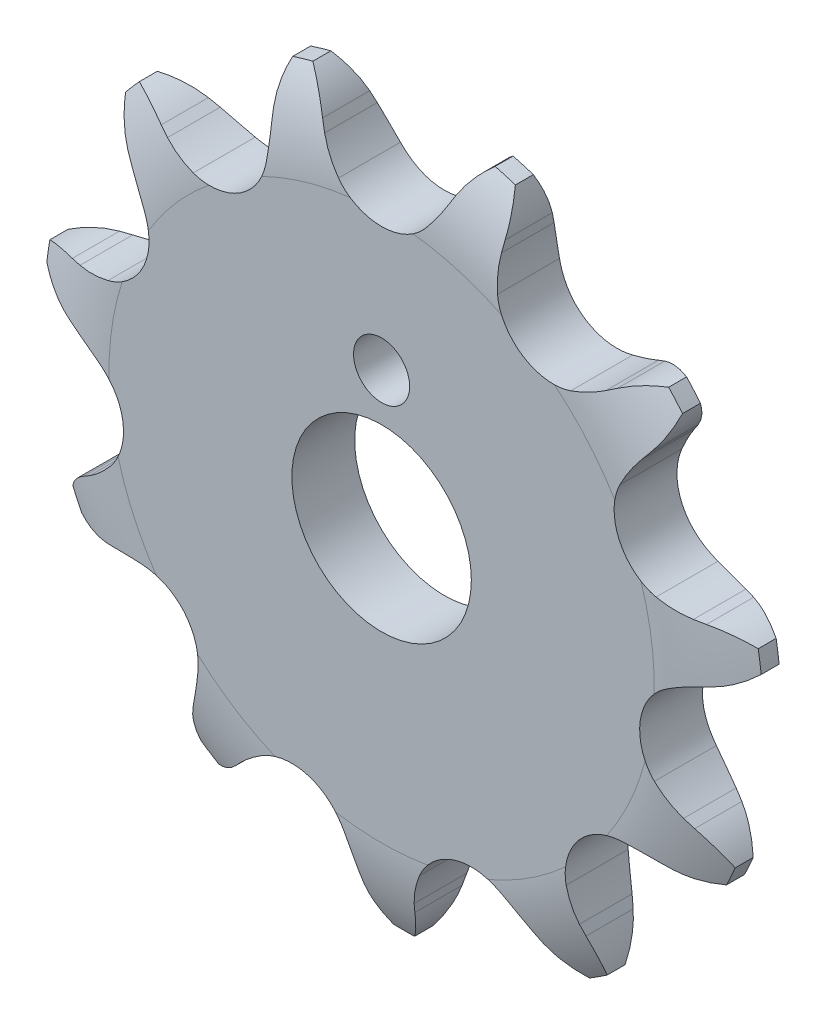
from build123d import *

# Parameters (mm, degrees)
CUT_EXTRUDE1_DEPTH      = 23.702796484
CIRPATTERN1_COUNT       = 11
BOSS_EXTRUDE1_START     = 1.4
SKETCH2_R               = 9
BOSS_EXTRUDE1_DEPTH     = 10.2
CUT_EXTRUDE2_DEPTH      = 26.391477167
CUT_EXTRUDE2_DEPTH_BACK = 26.391477167
SKETCH3_R               = 4
SKETCH4_W               = 2.1
SKETCH4_H               = 7.124886824
SKETCH6_R               = 10
CUT_EXTRUDE5_DEPTH      = 20
SKETCH7_R               = 1.25
CUT_EXTRUDE6_DEPTH      = 2.8


with BuildPart() as part:
    # Sketch1 → Revolve1 (revolve)
    with BuildSketch(Plane(origin=(0, 0, 0), x_dir=(0, 0, -1), z_dir=(1, 0, 0))):
        with BuildLine():
            Line((1.4, 0), (-1.4, 0))
            Line((-1.4, 0), (-1.4, 12.149765609))
            ThreePointArc((-1.4, 12.149765609), (-1.145966692, 14.149765609), (-0.4, 16.022748956))
            Line((-0.4, 16.022748956), (0.4, 16.022748956))
            ThreePointArc((0.4, 16.022748956), (1.145966692, 14.149765609), (1.4, 12.149765609))
            Line((1.4, 12.149765609), (1.4, 0))
        make_face()
    revolve(axis=Axis((0, 0, -1.4), (0, 0, 1)))

    # Sketch0 → Cut-Extrude1 (cut, symmetric)
    with BuildSketch(Plane.XY):
        with BuildLine():
            Line((6.851812807, -12.761725234), (6.530130706, -12.427554209))
            ThreePointArc((6.530130706, -12.427554209), (5.989521454, -11.925828098), (5.39593742, -11.488054814))
            ThreePointArc((5.39593742, -11.488054814), (3.281412941, -11.175466177), (1.671559928, -12.581630715))
            ThreePointArc((1.671559928, -12.581630715), (1.408883369, -13.270824794), (1.22534754, -13.985179085))
            Line((1.22534754, -13.985179085), (1.135397832, -14.440216115))
            ThreePointArc((1.135397832, -14.440216115), (-0.69182945, -17.1500874), (-3.906596055, -17.739525775))
            ThreePointArc((-3.906596055, -17.739525775), (5.117555901, -17.428794825), (12.877149449, -12.811373444))
            ThreePointArc((12.877149449, -12.811373444), (9.85404124, -14.053540374), (6.851812807, -12.761725234))
        make_face()
    cut_extrude1 = extrude(amount=CUT_EXTRUDE1_DEPTH, both=True, mode=Mode.SUBTRACT)

    # CirPattern1: Cut-Extrude1 ×11 about axis
    cirpattern1_axis = Axis((0, 0, 0), (0, 0, 1))
    for i in range(1, CIRPATTERN1_COUNT):
        add(cut_extrude1.rotate(cirpattern1_axis, i * 360 / CIRPATTERN1_COUNT), mode=Mode.SUBTRACT)

    # Sketch2 → Boss-Extrude1 (add)
    with BuildSketch(Plane.XY.offset(BOSS_EXTRUDE1_START)):
        with Locations(Location((0, 0, 0), (0, 0, 270))):
            Circle(SKETCH2_R)
    extrude(amount=BOSS_EXTRUDE1_DEPTH)

    # Sketch3 → Cut-Extrude2 (cut, two sides: drawn at the far end of the back side and taken through both)
    with BuildSketch(Plane.XY.offset(-CUT_EXTRUDE2_DEPTH_BACK)):
        Circle(SKETCH3_R)
    extrude(amount=CUT_EXTRUDE2_DEPTH + CUT_EXTRUDE2_DEPTH_BACK, mode=Mode.SUBTRACT)

    # Sketch4 → Cut-Revolve1 (revolve, cut)
    with BuildSketch(Plane(origin=(0, 0, 0), x_dir=(0, 0, -1), z_dir=(1, 0, 0))):
        Polygon((-11.6, 9), (-11.6, 8.5), (-11.1, 9), align=None)
        with Locations((-2.45, 12.460305544)):
            Rectangle(SKETCH4_W, SKETCH4_H)
    revolve(axis=Axis((0, 0, -1.4), (0, 0, 1)), mode=Mode.SUBTRACT)

    # Sketch6 → Cut-Extrude5 (cut)
    with BuildSketch(Plane.XY.offset(1.4)):
        Circle(SKETCH6_R)
    extrude(amount=CUT_EXTRUDE5_DEPTH, mode=Mode.SUBTRACT)

    # Sketch7 → Cut-Extrude6 (cut)
    with BuildSketch(Plane.XY.offset(1.4)):
        with Locations((0, 6.1)):
            Circle(SKETCH7_R)
    extrude(amount=-CUT_EXTRUDE6_DEPTH, mode=Mode.SUBTRACT)


solid = part.part
